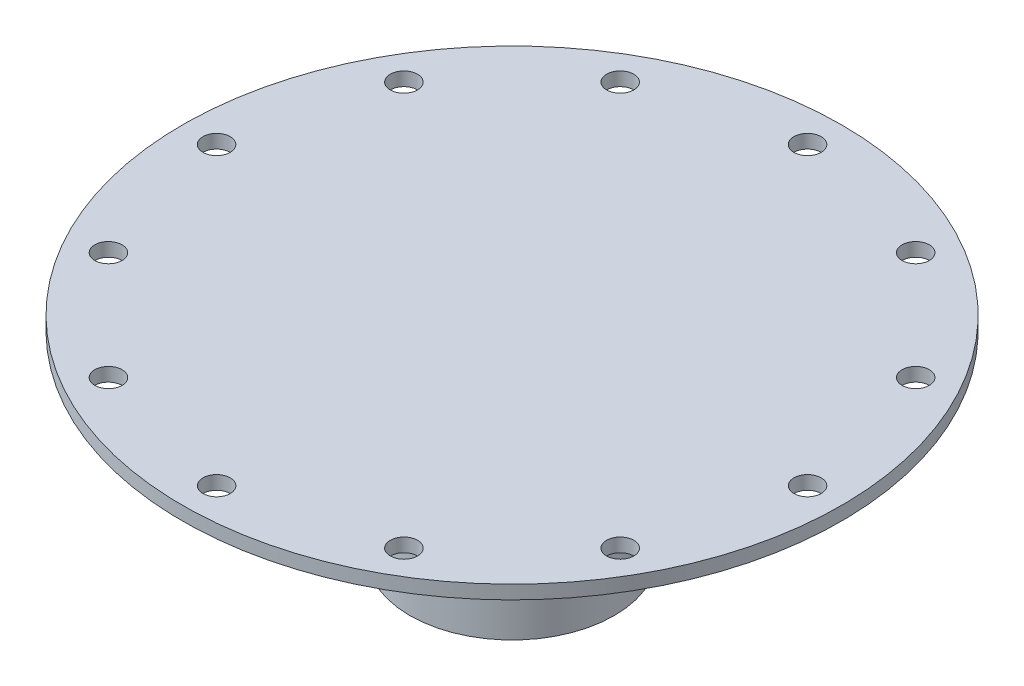
from build123d import *

# Parameters (mm, degrees)
BOSS_EXTRUDE1_START = 6
SKETCH2_R           = 72.5
SKETCH2_R_2         = 3
BOSS_EXTRUDE1_DEPTH = 3


with BuildPart() as part:
    # Sketch1 → Revolve1 (revolve)
    with BuildSketch(Plane(origin=(0, 0, 0), x_dir=(0, 0, -1), z_dir=(1, 0, 0)), mode=Mode.PRIVATE) as revolve1_sk:
        Polygon((0, 0), (0, -40), (22.5, -40), (22.5, 0), (50, 0), (50, 6), (0, 6), align=None)
    revolve(revolve1_sk.sketch.rotate(Axis((0, 6, 0), (0, -1, 0)), 180), axis=Axis((0, 6, 0), (0, -1, 0)))

    # Sketch2 → Boss-Extrude1 (add)
    with BuildSketch(Plane(origin=(0, 0, 0), x_dir=(1, 0, 0), z_dir=(0, 1, 0)).offset(BOSS_EXTRUDE1_START)):
        with Locations(Location((0, 0, 0), (0, 0, 90))):
            Circle(SKETCH2_R)
        with Locations(Location((0, -65, 0), (0, 0, 90))):
            Circle(SKETCH2_R_2, mode=Mode.SUBTRACT)
        with Locations(Location((-32.5, -56.291651246, 0), (0, 0, 90))):
            Circle(SKETCH2_R_2, mode=Mode.SUBTRACT)
        with Locations(Location((-56.291651246, -32.5, 0), (0, 0, 90))):
            Circle(SKETCH2_R_2, mode=Mode.SUBTRACT)
        with Locations(Location((-65, 0, 0), (0, 0, 90))):
            Circle(SKETCH2_R_2, mode=Mode.SUBTRACT)
        with Locations(Location((-56.291651246, 32.5, 0), (0, 0, 90))):
            Circle(SKETCH2_R_2, mode=Mode.SUBTRACT)
        with Locations(Location((-32.5, 56.291651246, 0), (0, 0, 90))):
            Circle(SKETCH2_R_2, mode=Mode.SUBTRACT)
        with Locations(Location((0, 65, 0), (0, 0, 90))):
            Circle(SKETCH2_R_2, mode=Mode.SUBTRACT)
        with Locations(Location((32.5, 56.291651246, 0), (0, 0, 90))):
            Circle(SKETCH2_R_2, mode=Mode.SUBTRACT)
        with Locations(Location((56.291651246, 32.5, 0), (0, 0, 90))):
            Circle(SKETCH2_R_2, mode=Mode.SUBTRACT)
        with Locations(Location((65, 0, 0), (0, 0, 90))):
            Circle(SKETCH2_R_2, mode=Mode.SUBTRACT)
        with Locations(Location((56.291651246, -32.5, 0), (0, 0, 90))):
            Circle(SKETCH2_R_2, mode=Mode.SUBTRACT)
        with Locations(Location((32.5, -56.291651246, 0), (0, 0, 90))):
            Circle(SKETCH2_R_2, mode=Mode.SUBTRACT)
    extrude(amount=-BOSS_EXTRUDE1_DEPTH)


solid = part.part
